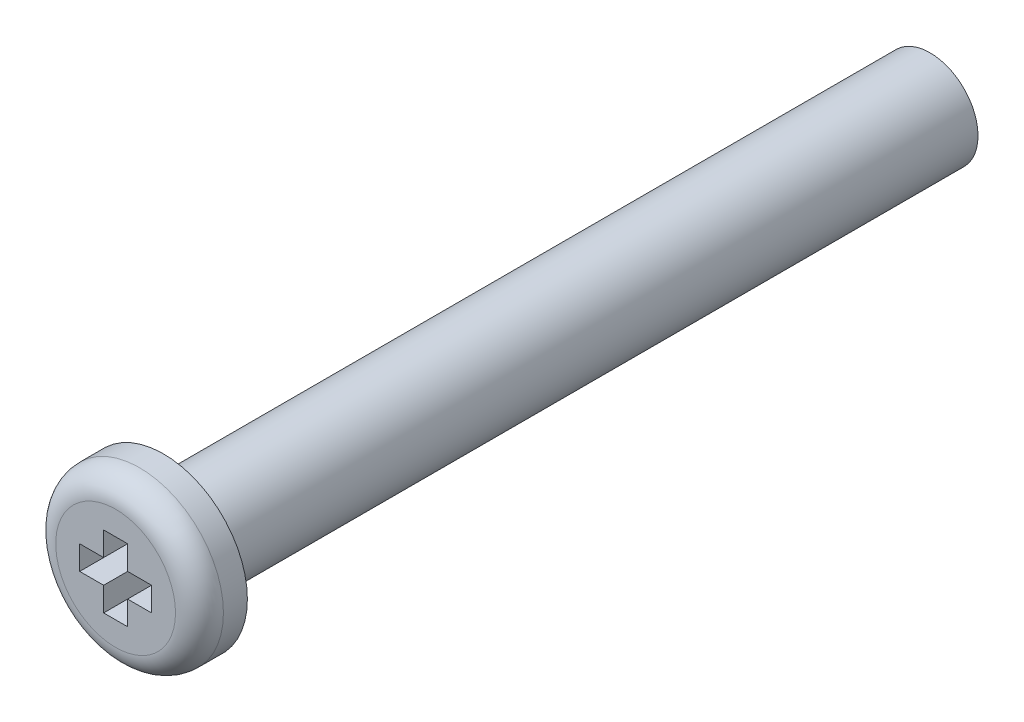
from build123d import *

# Parameters (mm, degrees)
SKETCH_1_R          = 2
EXTRUDE_1_DEPTH     = 32
SKETCH_2_R          = 3.5
EXTRUDE_2_DEPTH     = 2
FILLET_1_R          = 1
CUT_EXTRUDE_1_DEPTH = 2


with BuildPart() as part:
    # 草图1 → 凸台-拉伸1 (new body)
    with BuildSketch(Plane.XY):
        Circle(SKETCH_1_R)
    extrude(amount=EXTRUDE_1_DEPTH)

    # 草图2 → 凸台-拉伸2 (add)
    with BuildSketch(Plane.XY.offset(32)):
        Circle(SKETCH_2_R)
    extrude(amount=EXTRUDE_2_DEPTH)

    # 圆角1
    fillet_1_edges = [part.edges().sort_by_distance(p)[0] for p in [
        (-3.5, 0, 34),
    ]]
    fillet(fillet_1_edges, radius=FILLET_1_R)

    # 草图3 → 切除-拉伸1 (cut)
    with BuildSketch(Plane.XY.offset(34)):
        Polygon((0, 1.5), (0.5, 1.5), (0.5, 0.5), (1.5, 0.5), (1.5, -0.5), (0.5, -0.5), (0.5, -1.5), (-0.5, -1.5), (-0.5, -0.5), (-1.5, -0.5), (-1.5, 0.5), (-0.5, 0.5), (-0.5, 1.5), align=None)
    extrude(amount=-CUT_EXTRUDE_1_DEPTH, mode=Mode.SUBTRACT)


solid = part.part
